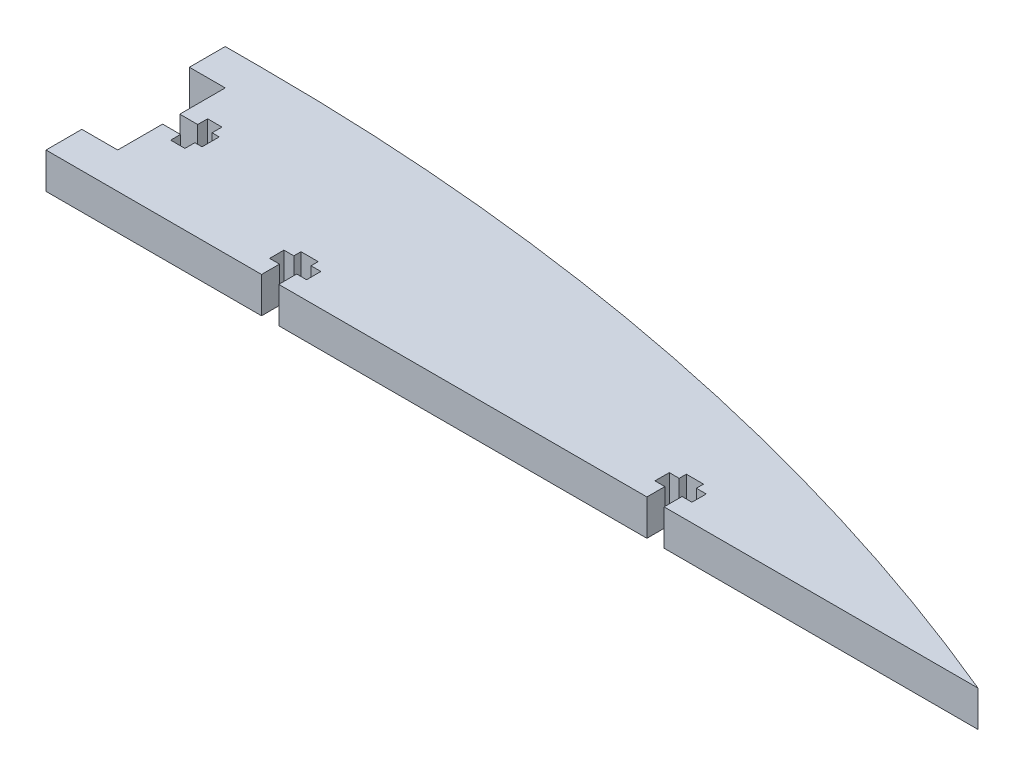
from build123d import *

# Parameters (mm, degrees)
BOSS_EXTRUDE1_DEPTH = 6.35


with BuildPart() as part:
    # Sketch1 → Boss-Extrude1 (new body)
    with BuildSketch(Plane(origin=(0, 0, 0), x_dir=(1, 0, 0), z_dir=(0, 1, 0))):
        with BuildLine():
            Line((-79.362966154, -13.293541536), (-79.362966154, -21.341955347))
            Line((-79.362966154, -21.341955347), (-76.187966154, -21.341955347))
            Line((-76.187966154, -21.341955347), (-76.187966154, -19.589355347))
            Line((-76.187966154, -19.589355347), (-73.647966154, -19.589355347))
            Line((-73.647966154, -19.589355347), (-73.647966154, -21.341955347))
            Line((-73.647966154, -21.341955347), (-72.377966154, -21.341955347))
            Line((-72.377966154, -21.341955347), (-72.377966154, -24.389814703))
            Line((-72.377966154, -24.389814703), (-73.647966154, -24.389814703))
            Line((-73.647966154, -24.389814703), (-73.647966154, -26.142414703))
            Line((-73.647966154, -26.142414703), (-76.187966154, -26.142414703))
            Line((-76.187966154, -26.142414703), (-76.187966154, -24.389814703))
            Line((-76.187966154, -24.389814703), (-79.362966154, -24.389814703))
            Line((-79.362966154, -24.389814703), (-79.362966154, -32.343541536))
            Line((-79.362966154, -32.343541536), (-85.712966154, -32.343541536))
            Line((-85.712966154, -32.343541536), (-85.712966154, -38.693541536))
            Line((-85.712966154, -38.693541536), (-79.362966154, -38.693541536))
            Line((-79.362966154, -38.693541536), (-47.528264268, -38.693541536))
            Line((-47.528264268, -38.693541536), (-47.528264268, -35.518541536))
            Line((-47.528264268, -35.518541536), (-49.280864268, -35.518541536))
            Line((-49.280864268, -35.518541536), (-49.280864268, -32.978541536))
            Line((-49.280864268, -32.978541536), (-47.528264268, -32.978541536))
            Line((-47.528264268, -32.978541536), (-47.528264268, -31.708541536))
            Line((-47.528264268, -31.708541536), (-44.480404912, -31.708541536))
            Line((-44.480404912, -31.708541536), (-44.480404912, -32.978541536))
            Line((-44.480404912, -32.978541536), (-42.727804912, -32.978541536))
            Line((-42.727804912, -32.978541536), (-42.727804912, -35.518541536))
            Line((-42.727804912, -35.518541536), (-44.480404912, -35.518541536))
            Line((-44.480404912, -35.518541536), (-44.480404912, -38.693541536))
            Line((-44.480404912, -38.693541536), (20.734235732, -38.693541536))
            Line((20.734235732, -38.693541536), (20.734235732, -35.518541536))
            Line((20.734235732, -35.518541536), (18.981635732, -35.518541536))
            Line((18.981635732, -35.518541536), (18.981635732, -32.978541536))
            Line((18.981635732, -32.978541536), (20.734235732, -32.978541536))
            Line((20.734235732, -32.978541536), (20.734235732, -31.708541536))
            Line((20.734235732, -31.708541536), (23.782095088, -31.708541536))
            Line((23.782095088, -31.708541536), (23.782095088, -32.978541536))
            Line((23.782095088, -32.978541536), (25.534695088, -32.978541536))
            Line((25.534695088, -32.978541536), (25.534695088, -35.518541536))
            Line((25.534695088, -35.518541536), (23.782095088, -35.518541536))
            Line((23.782095088, -35.518541536), (23.782095088, -38.693541536))
            Line((23.782095088, -38.693541536), (79.387033846, -38.693541536))
            ThreePointArc((79.387033846, -38.693541536), (1.583968625, -14.958867645), (-79.362966154, -6.943541536))
            Line((-79.362966154, -6.943541536), (-85.712966154, -6.943541536))
            Line((-85.712966154, -6.943541536), (-85.712966154, -13.293541536))
            Line((-85.712966154, -13.293541536), (-79.362966154, -13.293541536))
        make_face()
    extrude(amount=BOSS_EXTRUDE1_DEPTH)


solid = part.part
